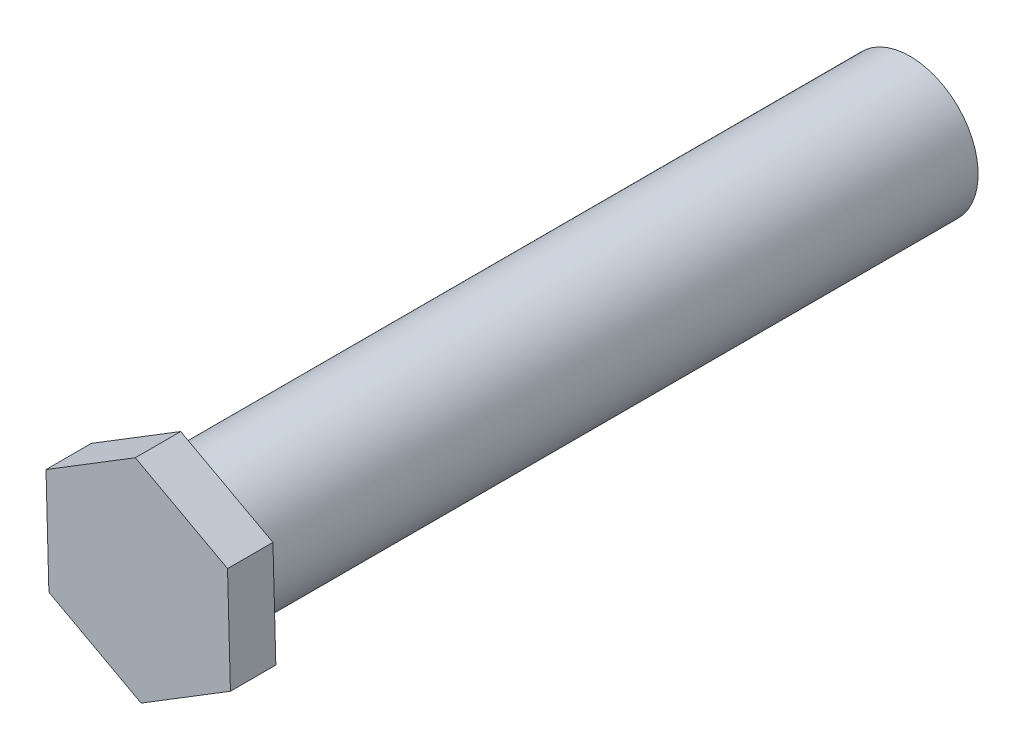
from build123d import *

# Parameters (mm, degrees)
BOSS_EXTRUDE1_DEPTH = 2
SKETCH4_R           = 3
BOSS_EXTRUDE2_DEPTH = 32


with BuildPart() as part:
    # Sketch2 → Boss-Extrude1 (new body)
    with BuildSketch(Plane.XY):
        Polygon((3.934748222, 2.418902595), (-0.127456986, 4.617043215), (-4.062205208, 2.19814062), (-3.934748222, -2.418902595), (0.127456986, -4.617043215), (4.062205208, -2.19814062), align=None)
    extrude(amount=BOSS_EXTRUDE1_DEPTH)

    # Sketch4 → Boss-Extrude2 (add)
    with BuildSketch(Plane(origin=(0, 0, 0), x_dir=(-1, 0, 0), z_dir=(0, 0, -1))):
        Circle(SKETCH4_R)
    extrude(amount=BOSS_EXTRUDE2_DEPTH)


solid = part.part
